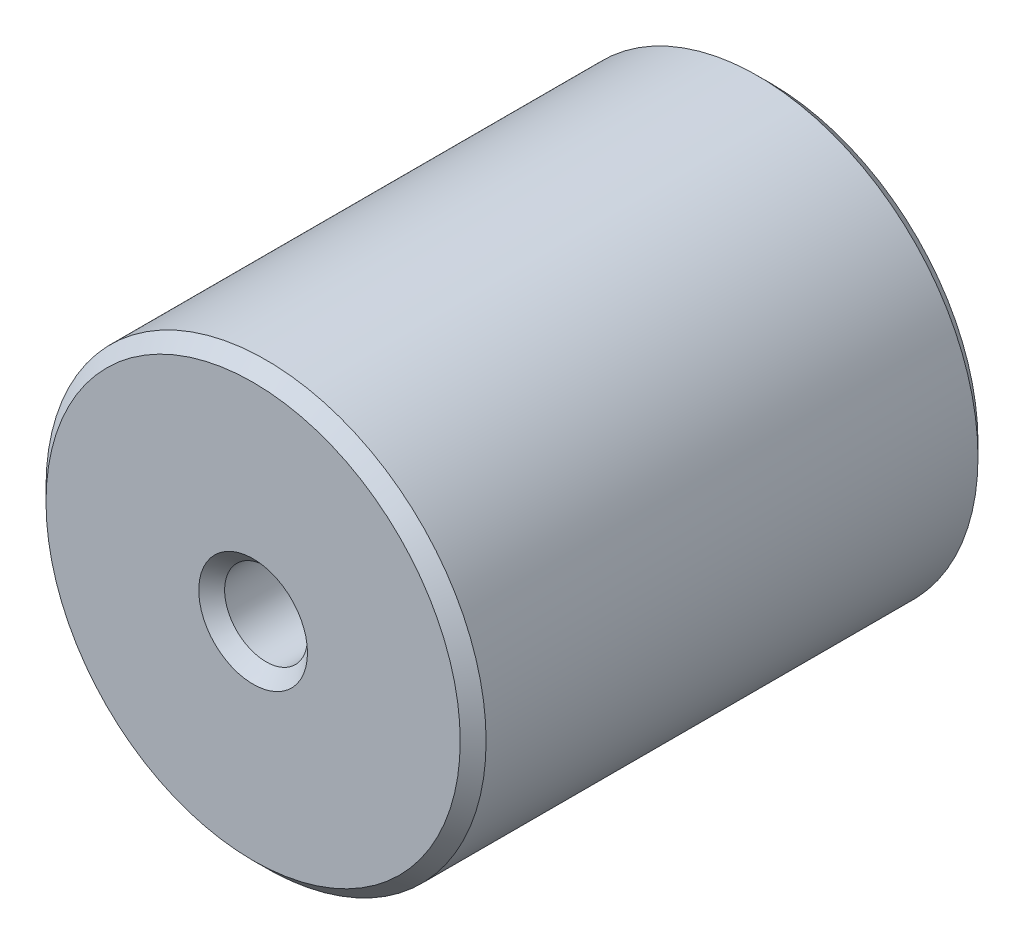
from build123d import *

# Parameters (mm, degrees)
ESQUISSE1_R        = 17
ESQUISSE1_R_2      = 3.2
BOSS_EXTRU_1_DEPTH = 40
CHANFREIN1_SIZE    = 1


with BuildPart() as part:
    # Esquisse1 → Boss.-Extru.1 (new body)
    with BuildSketch(Plane.XY):
        Circle(ESQUISSE1_R)
        Circle(ESQUISSE1_R_2, mode=Mode.SUBTRACT)
    extrude(amount=BOSS_EXTRU_1_DEPTH)

    # Chanfrein1
    chanfrein1_edges = [part.edges().sort_by_distance(p)[0] for p in [
        (-17, 0, 0),
        (-17, 0, 40),
        (-3.2, 0, 0),
        (-3.2, 0, 40),
    ]]
    chamfer(chanfrein1_edges, length=CHANFREIN1_SIZE)


solid = part.part
